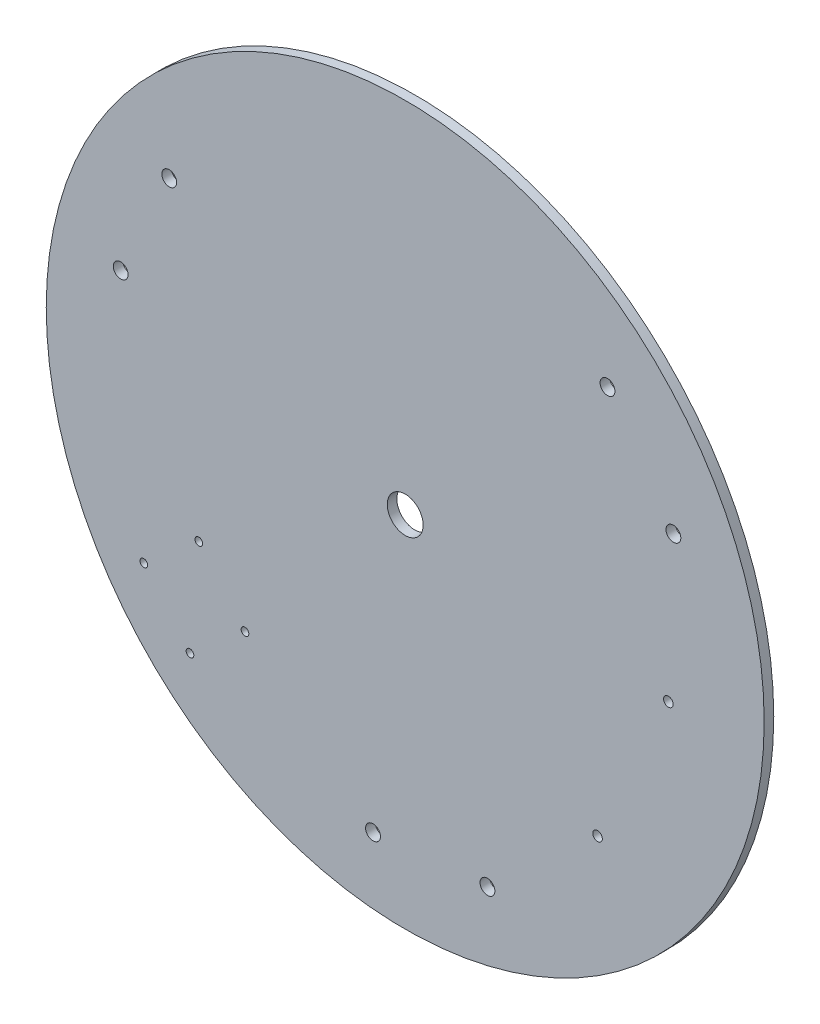
from build123d import *

# Parameters (mm, degrees)
SKETCH1_R           = 150
BOSS_EXTRUDE1_DEPTH = 4
SKETCH2_R           = 3.1
CUT_EXTRUDE1_DEPTH  = 4
CIRPATTERN1_COUNT   = 3
SKETCH3_R           = 2
CUT_EXTRUDE2_DEPTH  = 4
SKETCH4_R           = 7.5
CUT_EXTRUDE3_DEPTH  = 4
SKETCH6_R           = 1.6
CUT_EXTRUDE5_DEPTH  = 4


with BuildPart() as part:
    # Sketch1 → Boss-Extrude1 (new body)
    with BuildSketch(Plane.XY):
        Circle(SKETCH1_R)
    extrude(amount=BOSS_EXTRUDE1_DEPTH)

    # Sketch2 → Cut-Extrude1 (cut)
    with BuildSketch(Plane(origin=(0, 0, 0), x_dir=(-1, 0, 0), z_dir=(0, 0, -1))):
        with Locations((-84.532410842, 88.488821425)):
            Circle(SKETCH2_R)
        with Locations(Location((-112.064079787, 49.169523299, 0), (0, 0, 180))):
            Circle(SKETCH2_R)
    cut_extrude1 = extrude(amount=-CUT_EXTRUDE1_DEPTH, mode=Mode.SUBTRACT)

    # CirPattern1: Cut-Extrude1 ×3 about axis
    cirpattern1_axis = Axis((0, 0, 0), (0, 0, 1))
    for i in range(1, CIRPATTERN1_COUNT):
        add(cut_extrude1.rotate(cirpattern1_axis, i * 360 / CIRPATTERN1_COUNT), mode=Mode.SUBTRACT)

    # Sketch3 → Cut-Extrude2 (cut)
    with BuildSketch(Plane(origin=(0, 0, 0), x_dir=(-1, 0, 0), z_dir=(0, 0, -1))):
        with Locations((-109.9539568, -12.654144936)):
            Circle(SKETCH3_R)
        with Locations((-80.370678478, -76.095690029)):
            Circle(SKETCH3_R)
    extrude(amount=-CUT_EXTRUDE2_DEPTH, mode=Mode.SUBTRACT)

    # Sketch4 → Cut-Extrude3 (cut)
    with BuildSketch(Plane(origin=(0, 0, 0), x_dir=(-1, 0, 0), z_dir=(0, 0, -1))):
        Circle(SKETCH4_R)
    extrude(amount=-CUT_EXTRUDE3_DEPTH, mode=Mode.SUBTRACT)

    # Sketch6 → Cut-Extrude5 (cut)
    with BuildSketch(Plane(origin=(0, 0, 0), x_dir=(-1, 0, 0), z_dir=(0, 0, -1))):
        with Locations((66.962630167, -75.769427615)):
            Circle(SKETCH6_R)
        with Locations((89.94396346, -95.053055906)):
            Circle(SKETCH6_R)
        with Locations((109.227591751, -72.071722612)):
            Circle(SKETCH6_R)
        with Locations((86.246258457, -52.788094322)):
            Circle(SKETCH6_R)
    extrude(amount=-CUT_EXTRUDE5_DEPTH, mode=Mode.SUBTRACT)


solid = part.part
